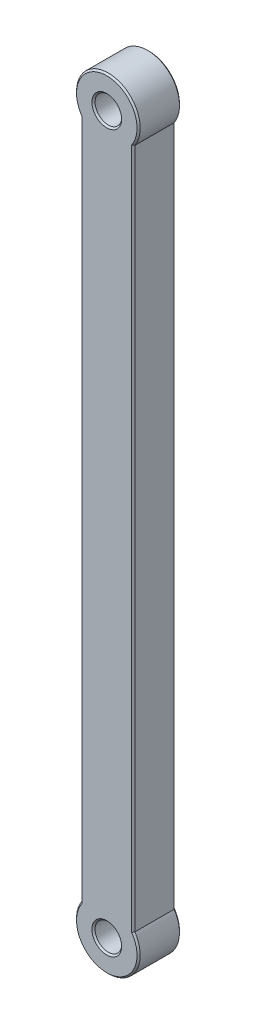
from build123d import *

# Parameters (mm, degrees)
EXTRUDE_1_DEPTH     = 8
SKETCH_2_R          = 6
EXTRUDE_2_DEPTH     = 8
SKETCH_3_R          = 2.5
CUT_EXTRUDE_1_DEPTH = 142.354165131
CHAMFER_1_SIZE      = 0.3


with BuildPart() as part:
    # 草图1 → 凸台-拉伸1 (new body)
    with BuildSketch(Plane.XY):
        with BuildLine():
            Line((-5, 0), (-5, 135))
            ThreePointArc((-5, 135), (0, 140), (5, 135))
            Line((5, 135), (5, 0))
            ThreePointArc((5, 0), (0, -5), (-5, 0))
        make_face()
    extrude(amount=EXTRUDE_1_DEPTH)

    # 草图2 → 凸台-拉伸2 (add)
    with BuildSketch(Plane.XY):
        with Locations((0, 135)):
            Circle(SKETCH_2_R)
        Circle(SKETCH_2_R)
    extrude(amount=EXTRUDE_2_DEPTH)

    # 草图3 → 切除-拉伸1 (cut, through all)
    with BuildSketch(Plane(origin=(0, 0, 0), x_dir=(-1, 0, 0), z_dir=(0, 0, -1))):
        with Locations((0, 135)):
            Circle(SKETCH_3_R)
        Circle(SKETCH_3_R)
    extrude(amount=-CUT_EXTRUDE_1_DEPTH, mode=Mode.SUBTRACT)

    # 倒角1
    chamfer_1_edges = [part.edges().sort_by_distance(p)[0] for p in [
        (-5, 67.5, 0),
        (-5, 67.5, 8),
        (0, 141, 8),
        (0, 141, 0),
        (5, 67.5, 0),
        (5, 67.5, 8),
        (0, -6, 0),
        (0, -6, 8),
        (2.5, 135, 8),
        (2.5, 135, 0),
        (2.5, 0, 8),
        (2.5, 0, 0),
    ]]
    chamfer(chamfer_1_edges, length=CHAMFER_1_SIZE)


solid = part.part
